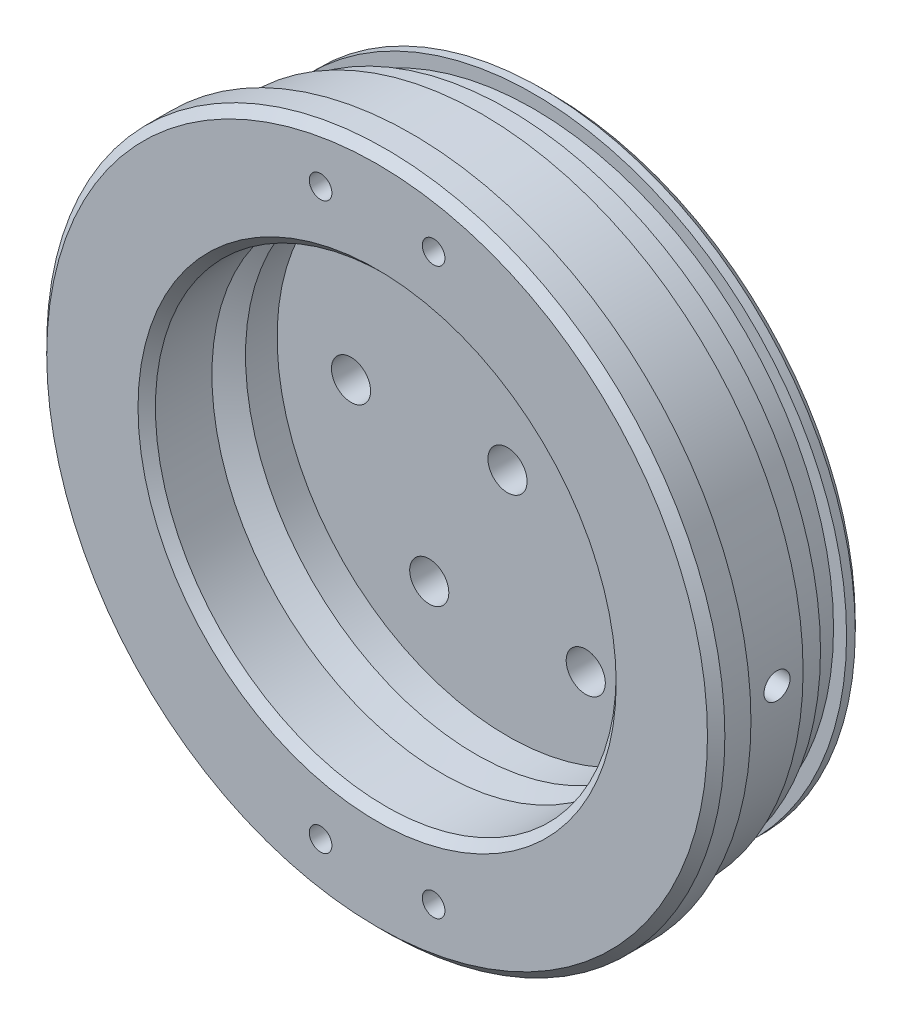
from build123d import *

# Parameters (mm, degrees)
SKETCH_1_R               = 39
EXTRUDE_1_DEPTH          = 4
SKETCH_3_R               = 37
EXTRUDE_2_DEPTH          = 8
SKETCH_4_R               = 36
EXTRUDE_3_DEPTH          = 8
SKETCH_5_W               = 3
SKETCH_5_H               = 1.5
SKETCH_7_R               = 27
CUT_EXTRUDE_1_DEPTH      = 17
CHAMFER_2_SIZE           = 1
SKETCH_18_R              = 1.3
CUT_EXTRUDE_6_DEPTH      = 7
EXTRUDE_START            = 17
SKETCH_19_R              = 27
EXTRUDE_4_DEPTH          = 17
SKETCH_20_R              = 26.5
CUT_EXTRUDE_7_DEPTH      = 15
SKETCH_21_R              = 2.25
CUT_EXTRUDE_8_DEPTH      = 15
SKETCH_23_R              = 1.3
CUT_EXTRUDE_9_DEPTH      = 7
CUT_EXTRUDE_START        = 38
SKETCH_25_R              = 1.5
CUT_EXTRUDE_11_DEPTH     = 4
PATTERN_CIRCULAR_2_COUNT = 2
CHAMFER_3_SIZE           = 1


with BuildPart() as part:
    # Sketch 1 → Бобышка-Вытянуть1 (new body)
    with BuildSketch(Plane.XY):
        Circle(SKETCH_1_R)
    extrude(amount=EXTRUDE_1_DEPTH)

    # Эскиз3 → Бобышка-Вытянуть2 (add)
    with BuildSketch(Plane(origin=(0, 0, 0), x_dir=(-1, 0, 0), z_dir=(0, 0, -1))):
        with Locations(Location((0, 0, 0), (0, 0, 180))):
            Circle(SKETCH_3_R)
    extrude(amount=EXTRUDE_2_DEPTH)

    # Эскиз4 → Бобышка-Вытянуть3 (add)
    with BuildSketch(Plane(origin=(0, 0, -8), x_dir=(-1, 0, 0), z_dir=(0, 0, -1))):
        Circle(SKETCH_4_R)
    extrude(amount=EXTRUDE_3_DEPTH)

    # Эскиз5 → Вырез-Повернуть1 (revolve, cut)
    with BuildSketch(Plane(origin=(0, 0, 0), x_dir=(0, 0, -1), z_dir=(1, 0, 0)), mode=Mode.PRIVATE) as cut_revolve_1_sk:
        with Locations((12.5, 35.25)):
            Rectangle(SKETCH_5_W, SKETCH_5_H)
    revolve(cut_revolve_1_sk.sketch.rotate(Axis((0, 0, 46.650977883), (0, 0, -1)), 90), axis=Axis((0, 0, 46.650977883), (0, 0, -1)), mode=Mode.SUBTRACT)

    # Эскиз7 → Вырез-Вытянуть1 (cut)
    with BuildSketch(Plane(origin=(0, 0, -16), x_dir=(-1, 0, 0), z_dir=(0, 0, -1))):
        Circle(SKETCH_7_R)
    extrude(amount=-CUT_EXTRUDE_1_DEPTH, mode=Mode.SUBTRACT)

    # Фаска2
    chamfer_2_edges = [part.edges().sort_by_distance(p)[0] for p in [
        (36, 0, -16),
    ]]
    chamfer(chamfer_2_edges, length=CHAMFER_2_SIZE)

    # Эскиз18 → Вырез-Вытянуть6 (cut)
    with BuildSketch(Plane.XY.offset(4)):
        with Locations((6.5, 32.5)):
            Circle(SKETCH_18_R)
        with Locations(Location((-6.5, 32.5, 0), (0, 0, 180))):
            Circle(SKETCH_18_R)
        with Locations(Location((6.5, -32.5, 0), (0, 0, 180))):
            Circle(SKETCH_18_R)
        with Locations((-6.5, -32.5)):
            Circle(SKETCH_18_R)
    extrude(amount=-CUT_EXTRUDE_6_DEPTH, mode=Mode.SUBTRACT)

    # Эскиз19 → Бобышка-Вытянуть4 (add)
    with BuildSketch(Plane(origin=(0, 0, 1), x_dir=(-1, 0, 0), z_dir=(0, 0, -1)).offset(EXTRUDE_START)):
        Circle(SKETCH_19_R)
    extrude(amount=-EXTRUDE_4_DEPTH)

    # Эскиз20 → Вырез-Вытянуть7 (cut)
    with BuildSketch(Plane.XY.offset(4)):
        Circle(SKETCH_20_R)
    extrude(amount=-CUT_EXTRUDE_7_DEPTH, mode=Mode.SUBTRACT)

    # Эскиз21 → Вырез-Вытянуть8 (cut)
    with BuildSketch(Plane.XY.offset(-11)):
        with Locations((-18, 0)):
            Circle(SKETCH_21_R)
        with Locations((-9, 15.588457268)):
            Circle(SKETCH_21_R)
        with Locations((9, 15.588457268)):
            Circle(SKETCH_21_R)
        with Locations((18, 0)):
            Circle(SKETCH_21_R)
        with Locations((9, -15.588457268)):
            Circle(SKETCH_21_R)
        with Locations((-9, -15.588457268)):
            Circle(SKETCH_21_R)
        Circle(SKETCH_21_R)
    extrude(amount=-CUT_EXTRUDE_8_DEPTH, mode=Mode.SUBTRACT)

    # Эскиз22 → Вырез-Повернуть2 (revolve, cut)
    with BuildSketch(Plane(origin=(0, 0, 0), x_dir=(0, 0, -1), z_dir=(1, 0, 0)), mode=Mode.PRIVATE) as cut_revolve_2_sk:
        Polygon((3.5, 26.5), (5.383390473, 29.817478189), (7.363463637, 26.5), align=None)
    revolve(cut_revolve_2_sk.sketch.rotate(Axis((0, 0, 32.005569053), (0, 0, -1)), 90), axis=Axis((0, 0, 32.005569053), (0, 0, -1)), mode=Mode.SUBTRACT)

    # Эскиз23 → Вырез-Вытянуть9 (cut)
    with BuildSketch(Plane(origin=(0, 0, -16), x_dir=(-1, 0, 0), z_dir=(0, 0, -1))):
        with Locations((23.180408503, 22.060568026)):
            Circle(SKETCH_23_R)
        with Locations(Location((-23.180408503, 22.060568026, 0), (0, 0, 180))):
            Circle(SKETCH_23_R)
        with Locations(Location((23.180408503, -22.060568026, 0), (0, 0, 180))):
            Circle(SKETCH_23_R)
        with Locations((-23.180408503, -22.060568026)):
            Circle(SKETCH_23_R)
    extrude(amount=-CUT_EXTRUDE_9_DEPTH, mode=Mode.SUBTRACT)

    # Эскиз25 → Вырез-Вытянуть11 (cut)
    with BuildSketch(Plane(origin=(0, 0, 0), x_dir=(0, 0, -1), z_dir=(1, 0, 0)).offset(CUT_EXTRUDE_START)):
        with Locations((5, 0)):
            Circle(SKETCH_25_R)
    cut_extrude_11 = extrude(amount=-CUT_EXTRUDE_11_DEPTH, mode=Mode.SUBTRACT)

    # Круговой массив2: Вырез-Вытянуть11 ×2 about axis
    pattern_circular_2_axis = Axis((0, 0, -8), (0, 0, 1))
    for i in range(1, PATTERN_CIRCULAR_2_COUNT):
        add(cut_extrude_11.rotate(pattern_circular_2_axis, i * 360 / PATTERN_CIRCULAR_2_COUNT), mode=Mode.SUBTRACT)

    # Фаска3
    chamfer_3_edges = [part.edges().sort_by_distance(p)[0] for p in [
        (-39, 0, 4),
        (-26.5, 0, 4),
    ]]
    chamfer(chamfer_3_edges, length=CHAMFER_3_SIZE)


solid = part.part
